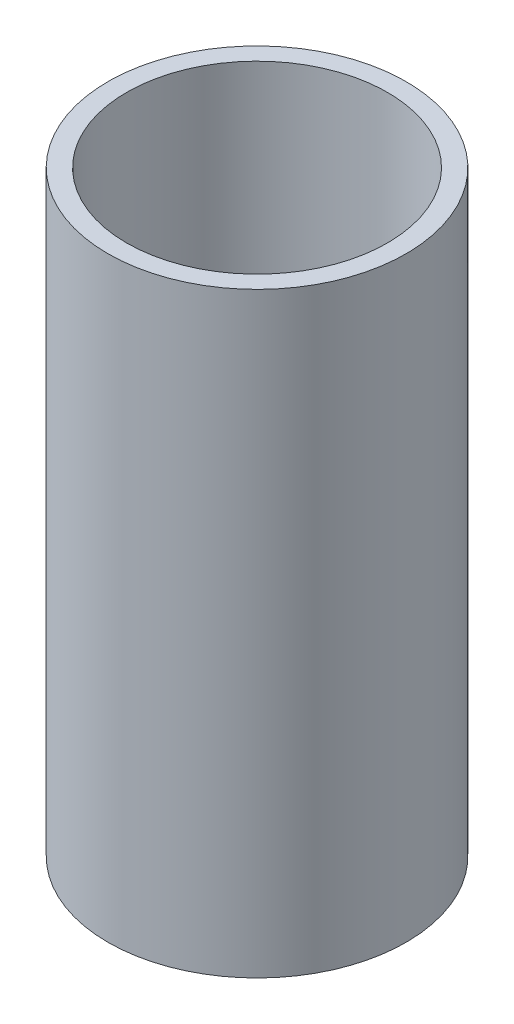
from build123d import *

# Parameters (mm, degrees)
SKETCH1_R           = 12.7
BOSS_EXTRUDE1_DEPTH = 50.8
SKETCH2_R           = 11.1125
CUT_EXTRUDE1_DEPTH  = 44.45


with BuildPart() as part:
    # Sketch1 → Boss-Extrude1 (new body)
    with BuildSketch(Plane(origin=(0, 0, 0), x_dir=(1, 0, 0), z_dir=(0, 1, 0))):
        with Locations(Location((0, 0, 0), (0, 0, 270))):
            Circle(SKETCH1_R)
    extrude(amount=BOSS_EXTRUDE1_DEPTH)

    # Sketch2 → Cut-Extrude1 (cut)
    with BuildSketch(Plane(origin=(0, 50.8, 0), x_dir=(1, 0, 0), z_dir=(0, 1, 0))):
        with Locations(Location((0, 0, 0), (0, 0, 270))):
            Circle(SKETCH2_R)
    extrude(amount=-CUT_EXTRUDE1_DEPTH, mode=Mode.SUBTRACT)


solid = part.part
